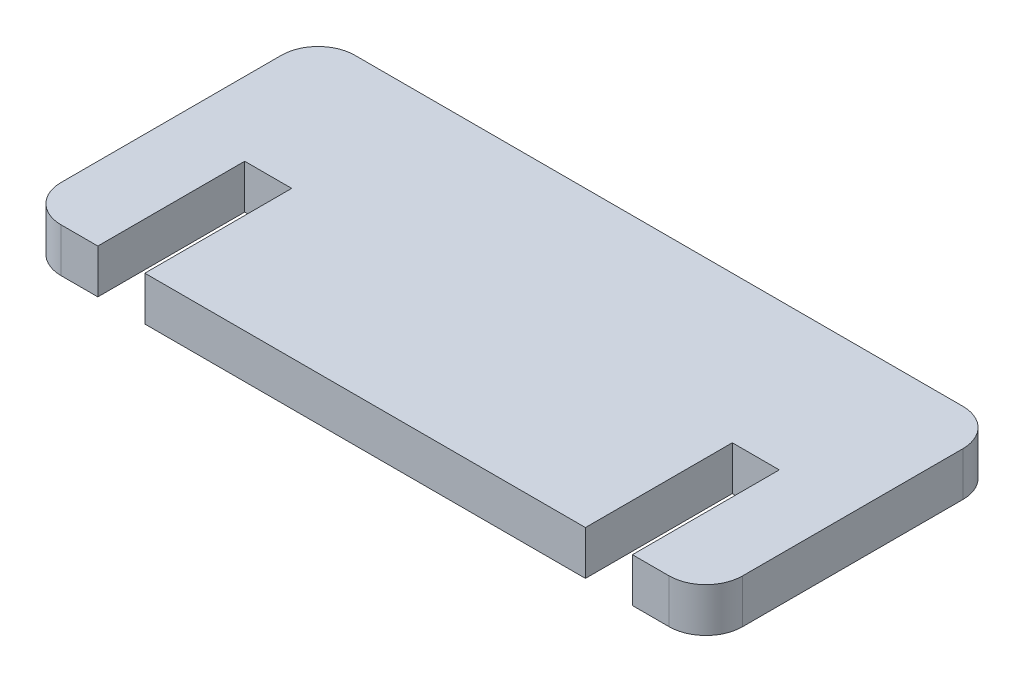
from build123d import *

# Parameters (mm, degrees)
EXTRUDE_1_DEPTH = 3


with BuildPart() as part:
    # 草图1 → 凸台-拉伸1 (new body)
    with BuildSketch(Plane(origin=(0, 0, 0), x_dir=(1, 0, 0), z_dir=(0, 1, 0))):
        with BuildLine():
            Line((15, 10), (20.7, 10))
            ThreePointArc((20.7, 10), (22.467766953, 9.267766953), (23.2, 7.5))
            Line((23.2, 7.5), (23.2, -7.5))
            ThreePointArc((23.2, -7.5), (22.467766953, -9.267766953), (20.7, -10))
            Line((20.7, -10), (18.2, -10))
            Line((18.2, -10), (18.2, 0))
            Line((18.2, 0), (15, 0))
            Line((15, 0), (15, -10))
            Line((15, -10), (-15, -10))
            Line((-15, -10), (-15, 0))
            Line((-15, 0), (-18.2, 0))
            Line((-18.2, 0), (-18.2, -10))
            Line((-18.2, -10), (-20.7, -10))
            ThreePointArc((-20.7, -10), (-22.467766953, -9.267766953), (-23.2, -7.5))
            Line((-23.2, -7.5), (-23.2, 7.5))
            ThreePointArc((-23.2, 7.5), (-22.467766953, 9.267766953), (-20.7, 10))
            Line((-20.7, 10), (-15, 10))
            Line((-15, 10), (15, 10))
        make_face()
    extrude(amount=EXTRUDE_1_DEPTH)


solid = part.part
